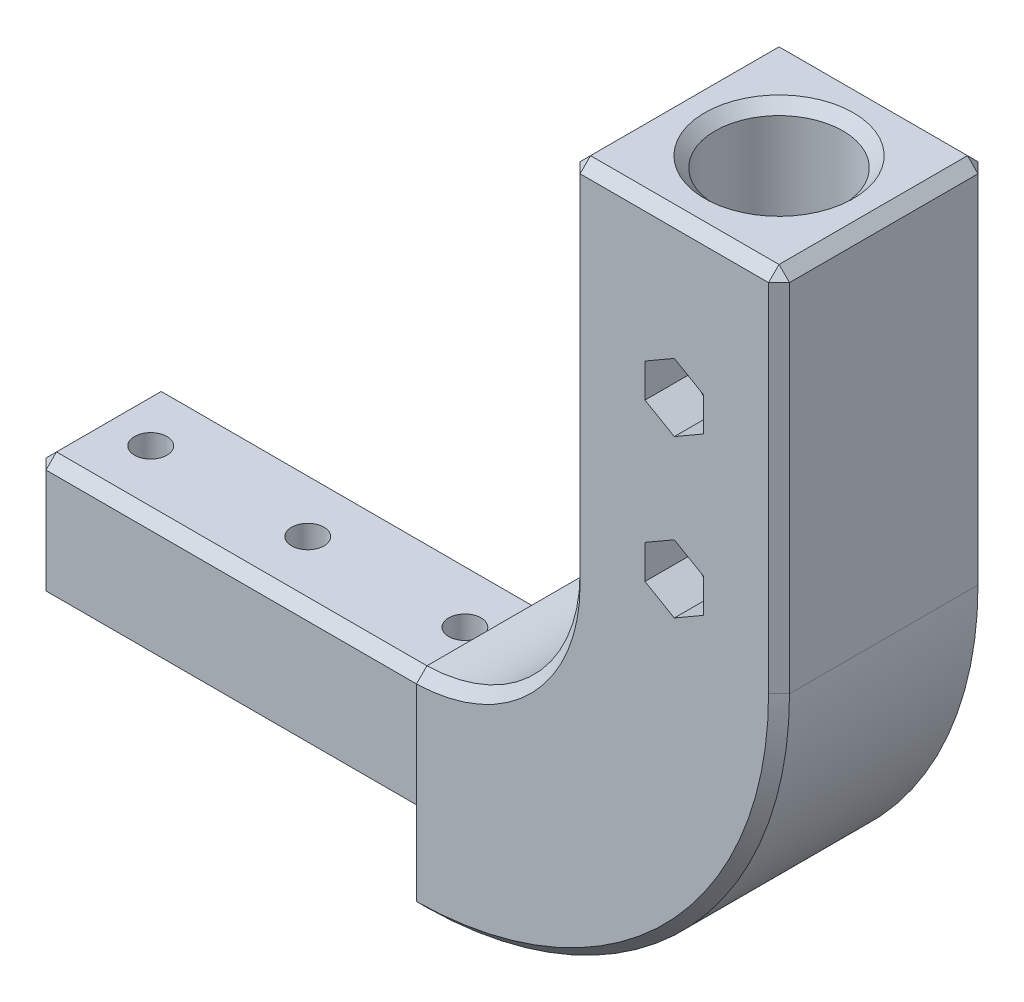
from build123d import *

# Parameters (mm, degrees)
SKETCH_13_R          = 1.55
EXTRUDE_6_DEPTH      = 20
SKETCH_15_R          = 6.1
CUT_EXTRUDE_4_DEPTH  = 40.1
SKETCH_16_R          = 1.55
CUT_EXTRUDE_5_DEPTH  = 93.330926639
CUT_EXTRUDE_7_DEPTH  = 105.522724888
EXTRUDE_8_DEPTH      = 20
CUT_EXTRUDE_8_DEPTH  = 4
CUT_EXTRUDE_9_DEPTH  = 5
SKETCH_29_W          = 20
SKETCH_29_H          = 20
SKETCH_29_W_2        = 12
SKETCH_29_H_2        = 12
CUT_EXTRUDE_11_DEPTH = 40.376839
CHAMFER_7_SIZE       = 1


with BuildPart() as part:
    # 草图13 → 凸台-拉伸6 (new body)
    with BuildSketch(Plane.XY):
        Polygon((0, 0), (45, 0), (75, 0), (75, 70), (55, 70), (55, 20), (45, 20), (0, 20), align=None)
        with Locations((65, 40)):
            Circle(SKETCH_13_R, mode=Mode.SUBTRACT)
        with Locations((65, 55)):
            Circle(SKETCH_13_R, mode=Mode.SUBTRACT)
    extrude(amount=EXTRUDE_6_DEPTH)

    # 草图15 → 切除-拉伸4 (cut)
    with BuildSketch(Plane(origin=(0, 70, 0), x_dir=(1, 0, 0), z_dir=(0, 1, 0))):
        with Locations(Location((65, -10, 0), (0, 0, 270))):
            Circle(SKETCH_15_R)
    extrude(amount=-CUT_EXTRUDE_4_DEPTH, mode=Mode.SUBTRACT)

    # 草图16 → 切除-拉伸5 (cut, through all)
    with BuildSketch(Plane(origin=(0, 20, 0), x_dir=(1, 0, 0), z_dir=(0, 1, 0))):
        with Locations(Location((5, -10, 0), (0, 0, 270))):
            Circle(SKETCH_16_R)
        with Locations(Location((20, -10, 0), (0, 0, 270))):
            Circle(SKETCH_16_R)
        with Locations(Location((35, -10, 0), (0, 0, 270))):
            Circle(SKETCH_16_R)
    extrude(amount=-CUT_EXTRUDE_5_DEPTH, mode=Mode.SUBTRACT)

    # 草图24 → 切除-拉伸7 (cut, through all)
    with BuildSketch(Plane(origin=(0, 0, 0), x_dir=(-1, 0, 0), z_dir=(0, 0, -1))):
        with BuildLine():
            Line((-75, 35), (-75, 0))
            Line((-75, 0), (-40, 0))
            ThreePointArc((-40, 0), (-64.748737342, 10.251262658), (-75, 35))
        make_face()
    extrude(amount=-CUT_EXTRUDE_7_DEPTH, mode=Mode.SUBTRACT)

    # 草图25 → 凸台-拉伸8 (add)
    with BuildSketch(Plane(origin=(0, 0, 0), x_dir=(-1, 0, 0), z_dir=(0, 0, -1))):
        with BuildLine():
            Line((-55, 34.995265669), (-55, 20))
            Line((-55, 20), (-40.376838854, 20))
            ThreePointArc((-40.376838854, 20), (-50.739007934, 24.522744072), (-55, 34.995265669))
        make_face()
    extrude(amount=-EXTRUDE_8_DEPTH)

    # 草图26 → 切除-拉伸8 (cut)
    with BuildSketch(Plane.XZ):
        Polygon((4.044652328, 6.911206682), (7.197299644, 7.628247988), (8.152647316, 10.717041306), (5.955347672, 13.088793318), (2.802700356, 12.371752012), (1.847352684, 9.282958694), align=None)
        Polygon((19.044652328, 6.911206682), (22.197299644, 7.628247988), (23.152647316, 10.717041306), (20.955347672, 13.088793318), (17.802700356, 12.371752012), (16.847352684, 9.282958694), align=None)
        Polygon((34.044652328, 6.911206682), (37.197299644, 7.628247988), (38.152647316, 10.717041306), (35.955347672, 13.088793318), (32.802700356, 12.371752012), (31.847352684, 9.282958694), align=None)
    extrude(amount=-CUT_EXTRUDE_8_DEPTH, mode=Mode.SUBTRACT)

    # 草图27 → 切除-拉伸9 (cut)
    with BuildSketch(Plane(origin=(0, 0, 20), x_dir=(-1, 0, 0), z_dir=(0, 0, -1))):
        Polygon((-65, 36.766838493), (-62.2, 38.383419246), (-62.2, 41.616580754), (-65, 43.233161507), (-67.8, 41.616580754), (-67.8, 38.383419246), align=None)
        Polygon((-65, 51.766838493), (-62.2, 53.383419246), (-62.2, 56.616580754), (-65, 58.233161507), (-67.8, 56.616580754), (-67.8, 53.383419246), align=None)
    extrude(amount=CUT_EXTRUDE_9_DEPTH, mode=Mode.SUBTRACT)

    # 草图29 → 切除-拉伸11 (cut)
    with BuildSketch(Plane.ZY):
        with Locations((10, 10)):
            Rectangle(SKETCH_29_W, SKETCH_29_H)
        with Locations((10, 10)):
            Rectangle(SKETCH_29_W_2, SKETCH_29_H_2, mode=Mode.SUBTRACT)
    extrude(amount=-CUT_EXTRUDE_11_DEPTH, mode=Mode.SUBTRACT)

    # 倒角7
    chamfer_7_edges = [part.edges().sort_by_distance(p)[0] for p in [
        (55, 70, 10),
        (75, 70, 10),
        (65, 70, 20),
        (64.881613342, 10.384855932, 0),
        (64.881613342, 10.384855932, 20),
        (0, 16, 10),
        (20.1884195, 16, 16),
        (0, 4, 10),
        (20.1884195, 4, 4),
        (0, 10, 16),
        (20.1884195, 4, 16),
        (0, 10, 4),
        (20.1884195, 16, 4),
        (55, 52.497632834, 20),
        (65, 70, 3.9),
        (75, 52.5, 0),
        (75, 52.5, 20),
        (50.739007934, 24.522744072, 0),
        (50.739007934, 24.522744072, 20),
        (55, 52.497632834, 0),
        (65, 70, 0),
    ]]
    chamfer(chamfer_7_edges, length=CHAMFER_7_SIZE)


solid = part.part
